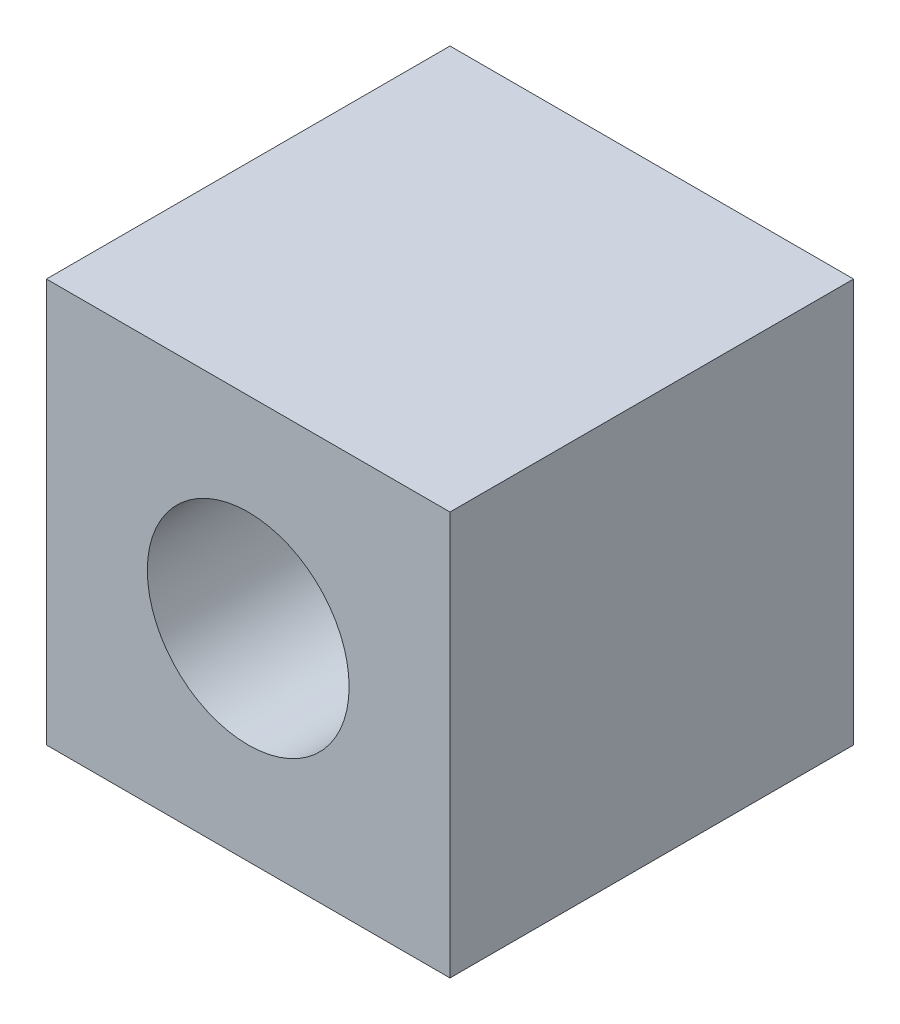
from build123d import *

# Parameters (mm, degrees)
SKETCH1_W           = 10
SKETCH1_H           = 10
BOSS_EXTRUDE1_DEPTH = 10
SKETCH2_R           = 2.5
CUT_EXTRUDE1_DEPTH  = 18.320508076


with BuildPart() as part:
    # Sketch1 → Boss-Extrude1 (new body)
    with BuildSketch(Plane.XY):
        with Locations((5, 5)):
            Rectangle(SKETCH1_W, SKETCH1_H)
    extrude(amount=BOSS_EXTRUDE1_DEPTH)

    # Sketch2 → Cut-Extrude1 (cut, through all)
    with BuildSketch(Plane.XY.offset(10)):
        with Locations((5, 5)):
            Circle(SKETCH2_R)
    extrude(amount=-CUT_EXTRUDE1_DEPTH, mode=Mode.SUBTRACT)


solid = part.part
